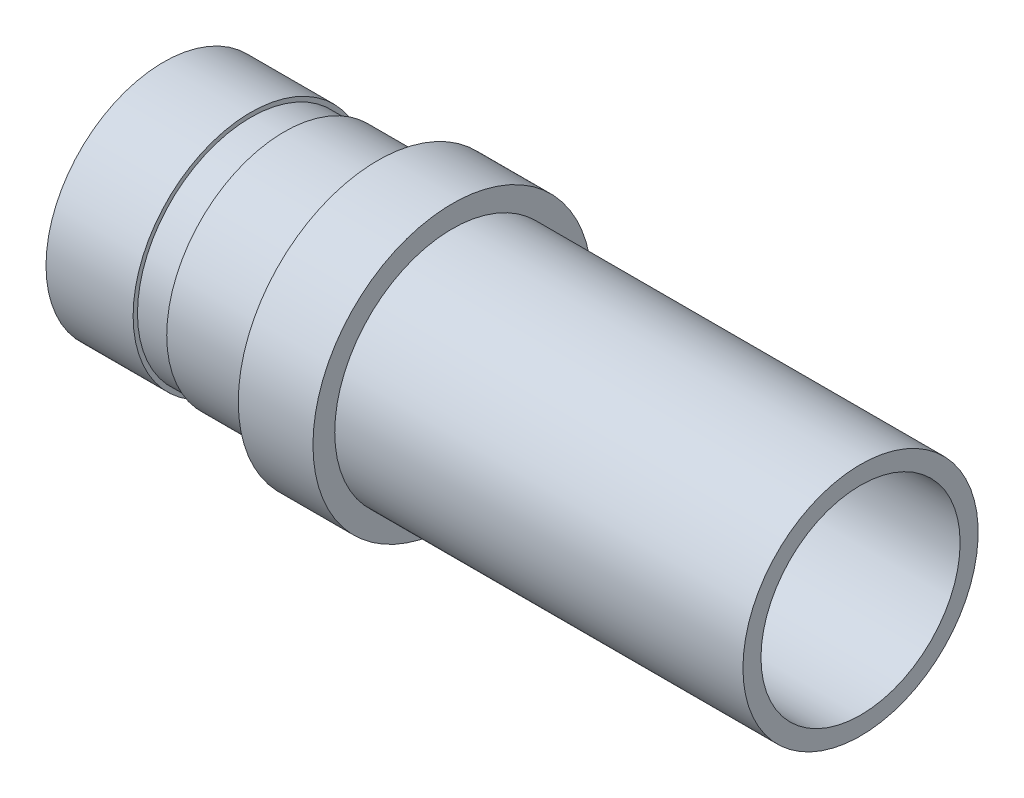
from build123d import *


with BuildPart() as part:
    # Esboço1 → Revolução1 (revolve)
    with BuildSketch(Plane.XY, mode=Mode.PRIVATE) as revolu_o1_sk:
        Polygon((0, 4.725), (3.5, 4.725), (3.5, 4.55), (4.85, 4.55), (4.85, 4.725), (8.6, 4.725), (8.6, 5.6), (11.6, 5.6), (11.6, 4.725), (28, 4.725), (28, 4), (0, 4), align=None)
    revolve(revolu_o1_sk.sketch.rotate(Axis((0, 0, 0), (1, 0, 0)), 90), axis=Axis((0, 0, 0), (1, 0, 0)))


solid = part.part
